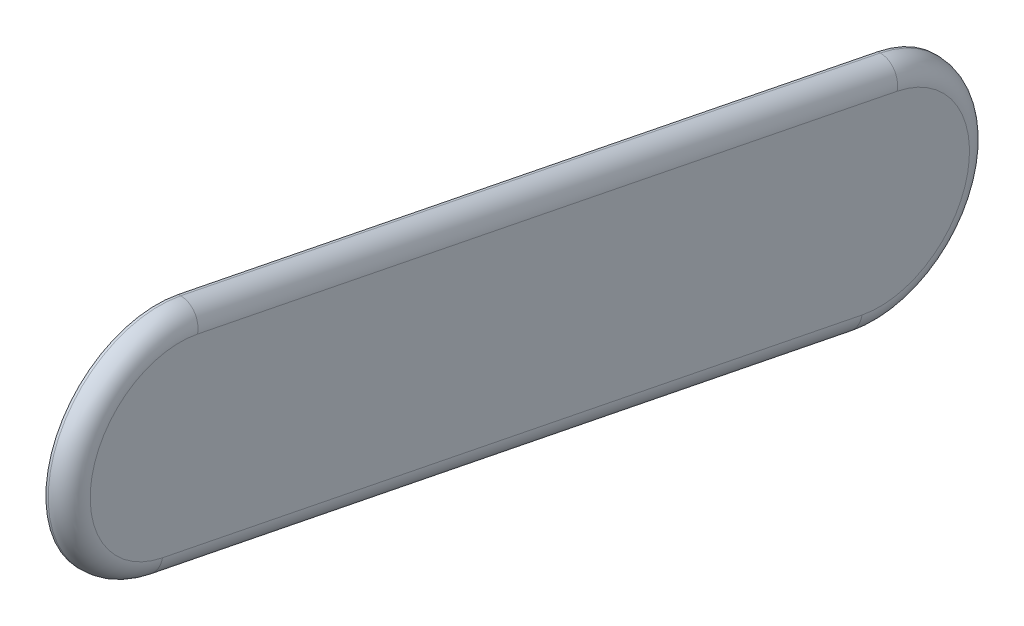
from build123d import *

# Parameters (mm, degrees)
BOSS_EXTRUDE2_DEPTH = 2.54
FILLET1_R           = 2.286


with BuildPart() as part:
    # Sketch1 → Boss-Extrude2 (new body)
    with BuildSketch(Plane(origin=(0, 0, 0), x_dir=(0, 0, -1), z_dir=(1, 0, 0))):
        with BuildLine():
            Line((-101.793975141, 71.500179704), (-25.593975141, 56.30363774))
            ThreePointArc((-25.593975141, 56.30363774), (-16.115925279, 42.103443032), (-30.316119987, 32.62539317))
            Line((-30.316119987, 32.62539317), (-106.516119987, 47.821935134))
            ThreePointArc((-106.516119987, 47.821935134), (-115.994169849, 62.022129842), (-101.793975141, 71.500179704))
        make_face()
    extrude(amount=BOSS_EXTRUDE2_DEPTH)

    # Fillet1
    fillet1_edges = [part.edges().sort_by_distance(p)[0] for p in [
        (2.54, 42.103443032, 16.115925279),
        (2.54, 63.901908722, 63.693975141),
        (2.54, 62.022129842, 115.994169849),
        (2.54, 40.223664152, 68.416119987),
    ]]
    fillet(fillet1_edges, radius=FILLET1_R)


solid = part.part
